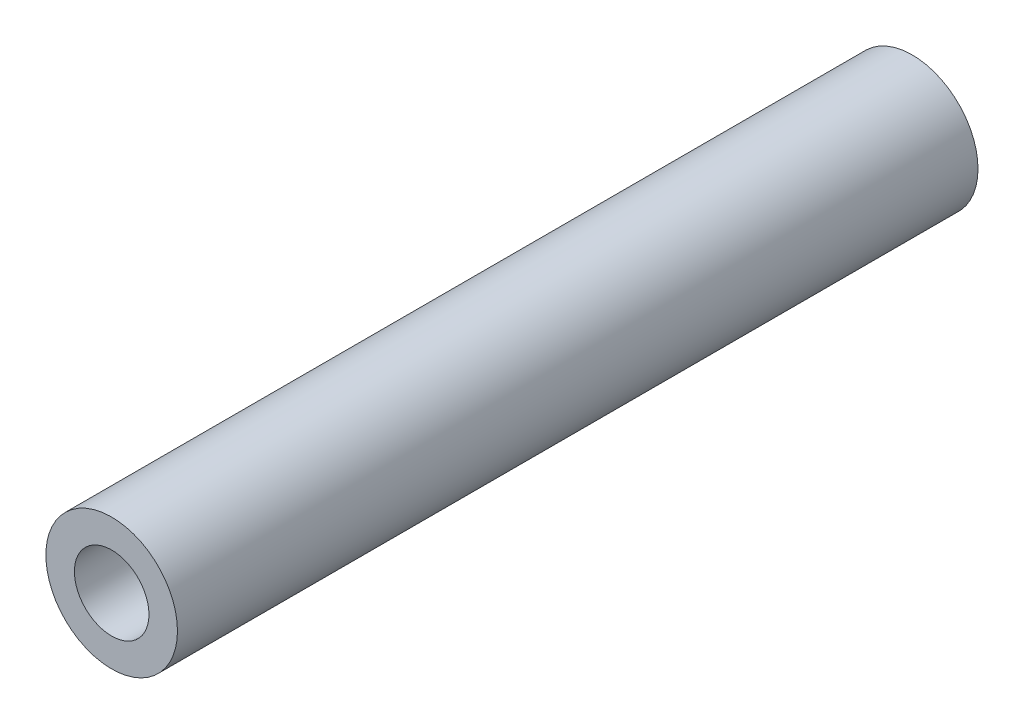
from build123d import *

# Parameters (mm, degrees)
MAIN_PROFILE_SKETCH_R   = 3
MAIN_PROFILE_SKETCH_R_2 = 1.7
MAIN_EXTRUSION_DEPTH    = 36.5


with BuildPart() as part:
    # Main Profile Sketch → Main Extrusion (new body)
    with BuildSketch(Plane.XY.offset(85)):
        with Locations((-234, -51)):
            Circle(MAIN_PROFILE_SKETCH_R)
        with Locations((-234, -51)):
            Circle(MAIN_PROFILE_SKETCH_R_2, mode=Mode.SUBTRACT)
    extrude(amount=-MAIN_EXTRUSION_DEPTH)


solid = part.part
